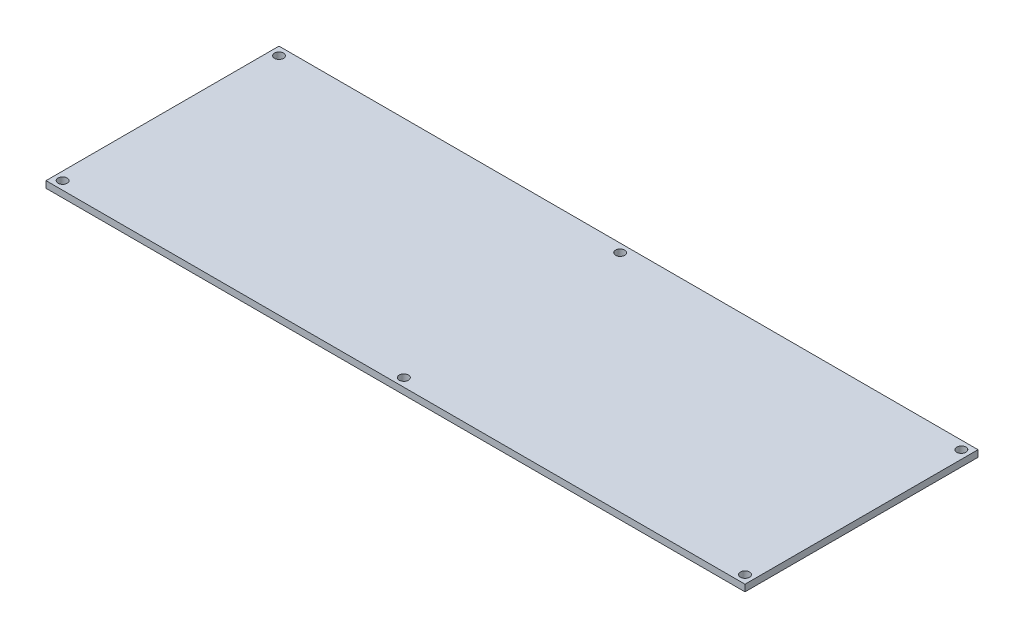
from build123d import *

# Parameters (mm, degrees)
SKETCH1_W           = 210
SKETCH1_H           = 70
SKETCH1_R           = 1.375
BOSS_EXTRUDE1_DEPTH = 1


with BuildPart() as part:
    # Sketch1 → Boss-Extrude1 (new, symmetric)
    with BuildSketch(Plane(origin=(0, 0, 0), x_dir=(1, 0, 0), z_dir=(0, 1, 0))):
        Rectangle(SKETCH1_W, SKETCH1_H)
        with Locations(Location((-102.5, 32.5, 0), (0, 0, 270))):
            Circle(SKETCH1_R, mode=Mode.SUBTRACT)
        with Locations(Location((-102.5, -32.5, 0), (0, 0, 90))):
            Circle(SKETCH1_R, mode=Mode.SUBTRACT)
        with Locations(Location((0, -32.5, 0), (0, 0, 270))):
            Circle(SKETCH1_R, mode=Mode.SUBTRACT)
        with Locations(Location((0, 32.5, 0), (0, 0, 90))):
            Circle(SKETCH1_R, mode=Mode.SUBTRACT)
        with Locations(Location((102.5, -32.5, 0), (0, 0, 270))):
            Circle(SKETCH1_R, mode=Mode.SUBTRACT)
        with Locations(Location((102.5, 32.5, 0), (0, 0, 90))):
            Circle(SKETCH1_R, mode=Mode.SUBTRACT)
    extrude(amount=BOSS_EXTRUDE1_DEPTH, both=True)


solid = part.part
